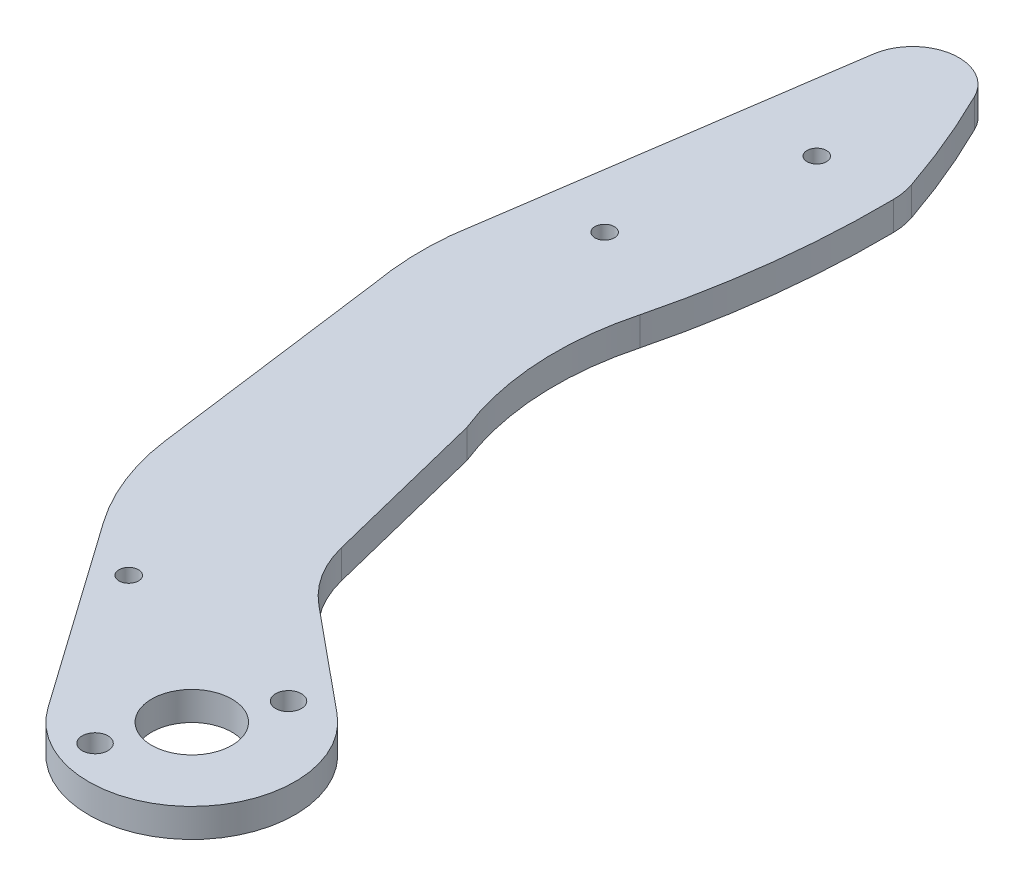
from build123d import *

# Parameters (mm, degrees)
SKETCH1_R                = 7
SKETCH1_R_2              = 1.7
BOSS_EXTRUDE2_DEPTH      = 5
CUT_EXTRUDE1_REACH       = 176.989
SKETCH3_R                = 1.7
M4_CLEARANCE_HOLE1_D     = 4.5
M4_CLEARANCE_HOLE1_DEPTH = 10.1
M4_CLEARANCE_HOLE1_TIP   = 1.351936393


with BuildPart() as part:
    # Sketch1 → Boss-Extrude2 (new body)
    with BuildSketch(Plane(origin=(0, 0, 0), x_dir=(1, 0, 0), z_dir=(0, 1, 0))):
        with BuildLine():
            Line((11.446477506, 13.891657666), (-6.606953629, 28.767362089))
            ThreePointArc((-6.606953629, 28.767362089), (-10.806918693, 33.53614027), (-13.298943796, 39.38171661))
            Line((-13.298943796, 39.38171661), (-20.530174792, 68.49716437))
            ThreePointArc((-20.530174792, 68.49716437), (-24.08112857, 84.393152776), (-22.456551163, 100.599709115))
            ThreePointArc((-22.456551163, 100.599709115), (-18.824269383, 120.221092129), (-17.76802696, 140.147870449))
            ThreePointArc((-17.76802696, 140.147870449), (-17.943181625, 142.067888002), (-18.417828761, 143.936539027))
            ThreePointArc((-18.417828761, 143.936539027), (-22.023480215, 153.489775682), (-26.256294904, 162.782156045))
            ThreePointArc((-26.256294904, 162.782156045), (-34.757388509, 167.168565439), (-41.482617684, 160.365590178))
            Line((-41.482617684, 160.365590178), (-50.932711484, 96.056215067))
            ThreePointArc((-50.932711484, 96.056215067), (-51.118515181, 89.191813761), (-50.383474997, 82.364351257))
            Line((-50.383474997, 82.364351257), (-44.819294227, 40.249739786))
            ThreePointArc((-44.819294227, 40.249739786), (-42.41581584, 30.91866257), (-37.850662253, 22.433081678))
            Line((-37.850662253, 22.433081678), (-14.709041721, -10.375167067))
            ThreePointArc((-14.709041721, -10.375167067), (12.242580486, -13.195424322), (11.446477506, 13.891657666))
        make_face()
        with Locations(Location((0, 0, 0), (0, 0, 270))):
            Circle(SKETCH1_R, mode=Mode.SUBTRACT)
        with Locations(Location((-27.673284612, 16.679008328, 0), (0, 0, 270))):
            Circle(SKETCH1_R_2, mode=Mode.SUBTRACT)
    extrude(amount=BOSS_EXTRUDE2_DEPTH)

    # Sketch3 → Cut-Extrude1 (cut, up to next)
    with BuildSketch(Plane(origin=(0, 5, 0), x_dir=(1, 0, 0), z_dir=(0, 1, 0)), mode=Mode.PRIVATE) as cut_extrude1_sk1:
        with Locations(Location((-31, 140, 0), (0, 0, 270))):
            Circle(SKETCH3_R)
    cut_extrude1_tool1 = extrude(cut_extrude1_sk1.sketch, amount=-CUT_EXTRUDE1_REACH, mode=Mode.PRIVATE) & part.part
    # Sketch3 → Cut-Extrude1 (cut, up to next)
    with BuildSketch(Plane(origin=(0, 5, 0), x_dir=(1, 0, 0), z_dir=(0, 1, 0)), mode=Mode.PRIVATE) as cut_extrude1_sk2:
        with Locations(Location((-38, 110, 0), (0, 0, 270))):
            Circle(SKETCH3_R)
    cut_extrude1_tool2 = extrude(cut_extrude1_sk2.sketch, amount=-CUT_EXTRUDE1_REACH, mode=Mode.PRIVATE) & part.part
    add(cut_extrude1_tool1.solids().sort_by_distance((-31, 5, -140))[0], mode=Mode.SUBTRACT)
    add(cut_extrude1_tool2.solids().sort_by_distance((-38, 5, -110))[0], mode=Mode.SUBTRACT)

    # M4 Clearance Hole1
    with Locations(Plane(origin=(-5.251206507, 5, 11.618404805), x_dir=(0, 0, 1), z_dir=(0, 1, 0))):
        with Locations((0, 0), (-23.23680961, 10.502413014)):
            Hole(M4_CLEARANCE_HOLE1_D / 2, depth=M4_CLEARANCE_HOLE1_DEPTH)
            with Locations((0, 0, -(M4_CLEARANCE_HOLE1_DEPTH + M4_CLEARANCE_HOLE1_TIP / 2))):  # 118° drill point
                Cone(0, M4_CLEARANCE_HOLE1_D / 2, M4_CLEARANCE_HOLE1_TIP, mode=Mode.SUBTRACT)


solid = part.part
